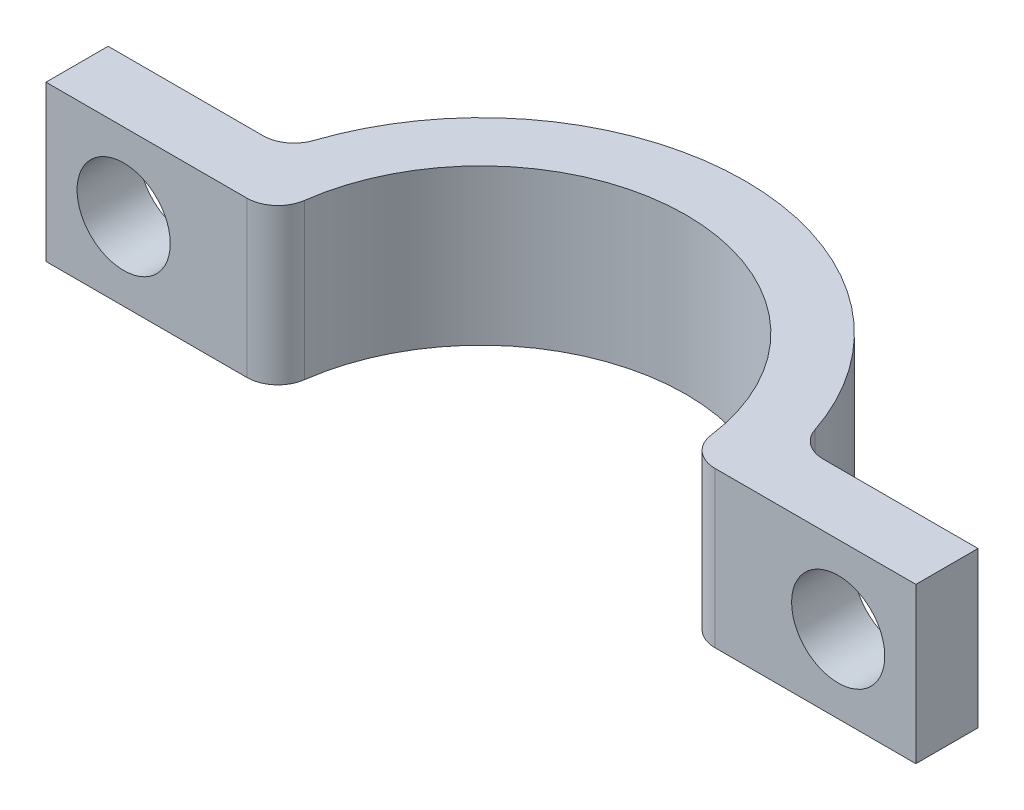
from build123d import *

# Parameters (mm, degrees)
BOSS_EXTRUDE1_DEPTH = 5
SKETCH2_R           = 1.5
CUT_EXTRUDE1_DEPTH  = 17.22498074
FILLET1_R           = 1


with BuildPart() as part:
    # Sketch1 → Boss-Extrude1 (new body)
    with BuildSketch(Plane(origin=(0, 0, 0), x_dir=(1, 0, 0), z_dir=(0, 1, 0))):
        with BuildLine():
            Line((-14, 0), (-8.5, 0))
            Line((-8.5, 0), (-6.6, 0))
            ThreePointArc((-6.6, 0), (-4.666904756, 4.666904756), (0, 6.6))
            Line((0, 6.6), (0, 8.5))
            ThreePointArc((0, 8.5), (-5.25594901, 6.680194608), (-8.261355821, 2))
            Line((-8.261355821, 2), (-14, 2))
            Line((-14, 2), (-14, 0))
        make_face()
        with BuildLine():
            Line((0, 8.5), (0, 6.6))
            ThreePointArc((0, 6.6), (4.666904756, 4.666904756), (6.6, 0))
            Line((6.6, 0), (8.5, 0))
            Line((8.5, 0), (14, 0))
            Line((14, 0), (14, 2))
            Line((14, 2), (8.261355821, 2))
            ThreePointArc((8.261355821, 2), (5.25594901, 6.680194608), (0, 8.5))
        make_face()
    extrude(amount=BOSS_EXTRUDE1_DEPTH)

    # Sketch2 → Cut-Extrude1 (cut, through all)
    with BuildSketch(Plane(origin=(0, 0, -2), x_dir=(-1, 0, 0), z_dir=(0, 0, -1))):
        with Locations((-11.5, 2.5)):
            Circle(SKETCH2_R)
        with Locations(Location((11.5, 2.5, 0), (0, 0, 180))):
            Circle(SKETCH2_R)
    extrude(amount=-CUT_EXTRUDE1_DEPTH, mode=Mode.SUBTRACT)

    # Fillet1
    fillet1_edges = [part.edges().sort_by_distance(p)[0] for p in [
        (-6.6, 2.5, 0),
        (-8.261355821, 2.5, -2),
        (8.261355821, 2.5, -2),
        (6.6, 2.5, 0),
    ]]
    fillet(fillet1_edges, radius=FILLET1_R)


solid = part.part
